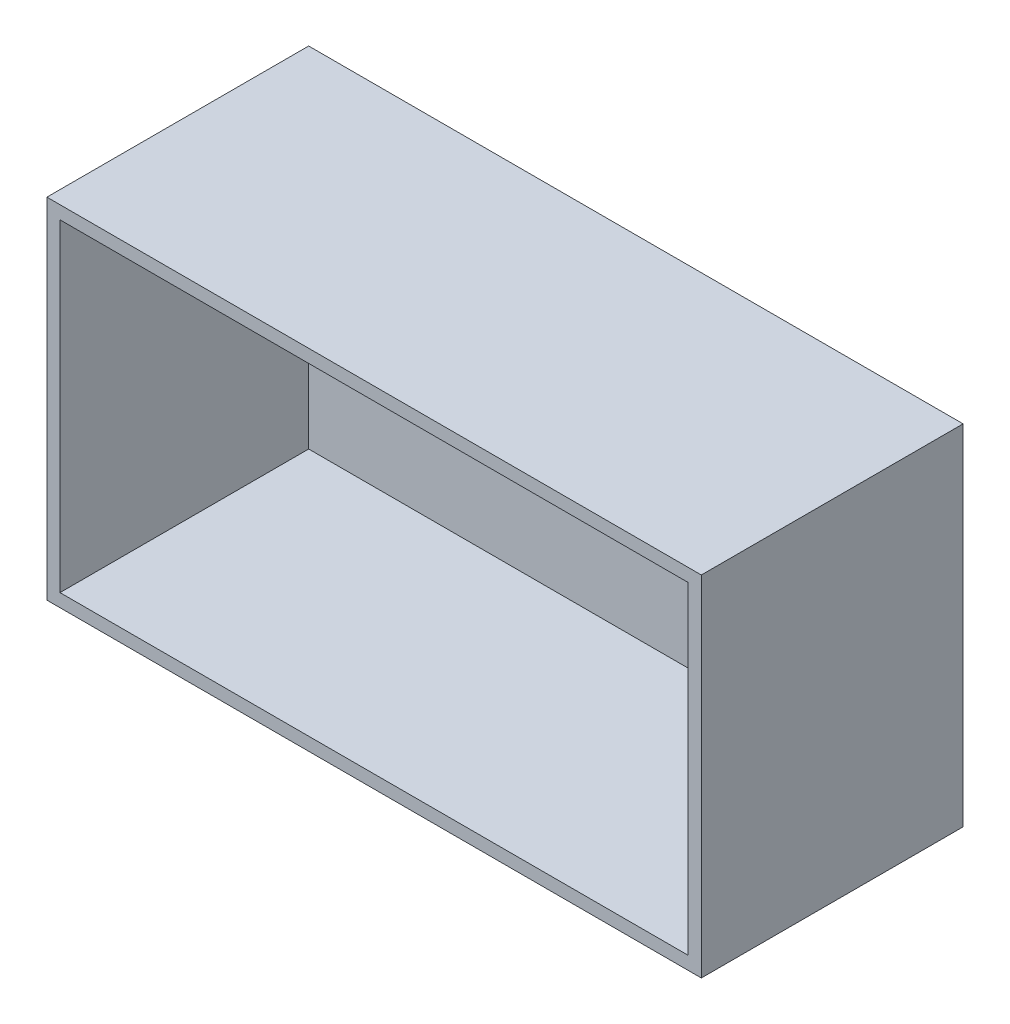
from build123d import *

# Parameters (mm, degrees)
SKETCH_1_W      = 150
SKETCH_1_H      = 80
EXTRUDE_1_DEPTH = 60
SHELL_1_T       = -3


with BuildPart() as part:
    # 草圖1 → 填料-伸長1 (new body)
    with BuildSketch(Plane.XY):
        with Locations((75, 40)):
            Rectangle(SKETCH_1_W, SKETCH_1_H)
    extrude(amount=EXTRUDE_1_DEPTH)

    # 薄殼1
    shell_1_openings = [part.faces().sort_by_distance(p)[0] for p in [
        (75, 40, 60),
    ]]
    offset(amount=SHELL_1_T, openings=shell_1_openings, kind=Kind.INTERSECTION)


solid = part.part
